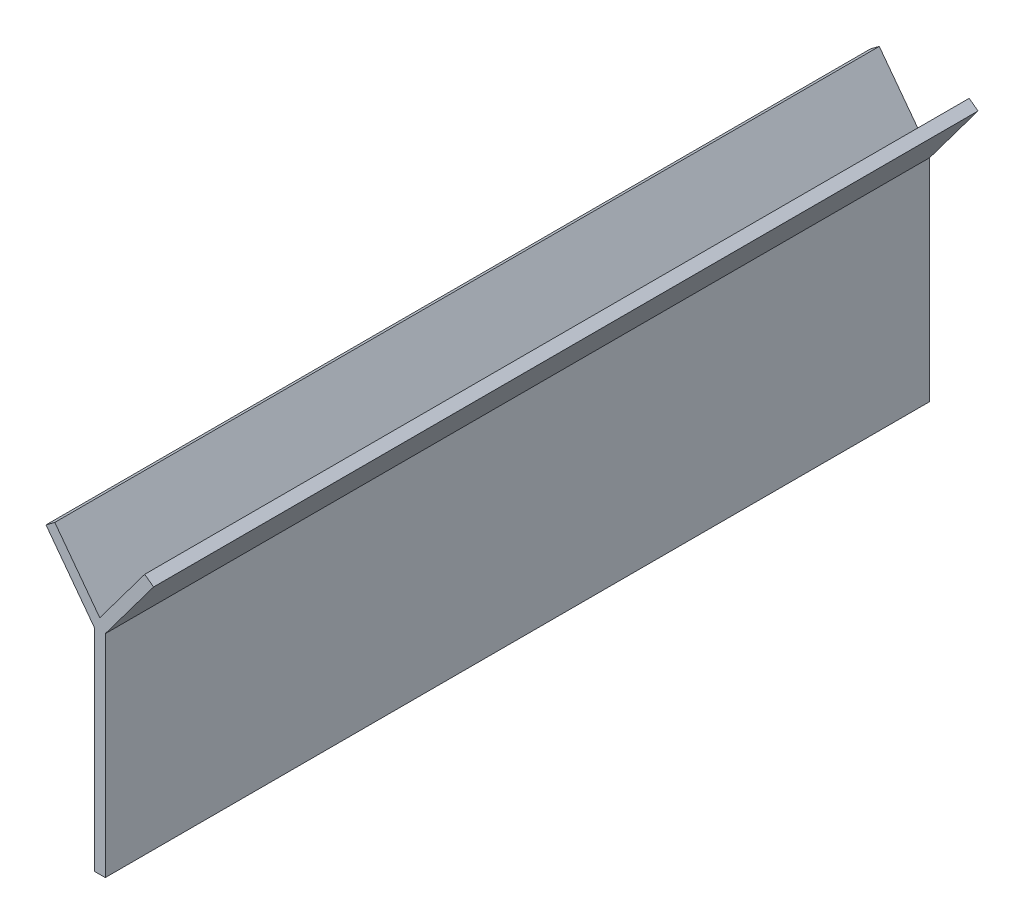
from build123d import *

# Parameters (mm, degrees)
EXTRUDE_1_DEPTH     = 400
SKETCH_2_R          = 93.157411664
CUT_EXTRUDE_1_DEPTH = 100


with BuildPart() as part:
    # 草图1 → 凸台-拉伸1 (new body)
    with BuildSketch(Plane.XY):
        Polygon((0, 3.340003743), (-16.362257115, 25.224522634), (-19.56584634, 22.829315737), (-2, -0.665003743), (-2, -77.540147309), (2, -77.540147309), (2, -0.665003743), (19.56584634, 22.829315737), (16.362257115, 25.224522634), align=None)
    extrude(amount=EXTRUDE_1_DEPTH)

    # 草图2 → 切除-拉伸1 (cut)
    with BuildSketch(Plane(origin=(0, 0, 0), x_dir=(-1, 0, 0), z_dir=(0, 0, -1))):
        with Locations((0, -10.324536186)):
            Circle(SKETCH_2_R)
    extrude(amount=-CUT_EXTRUDE_1_DEPTH, mode=Mode.SUBTRACT)


solid = part.part
